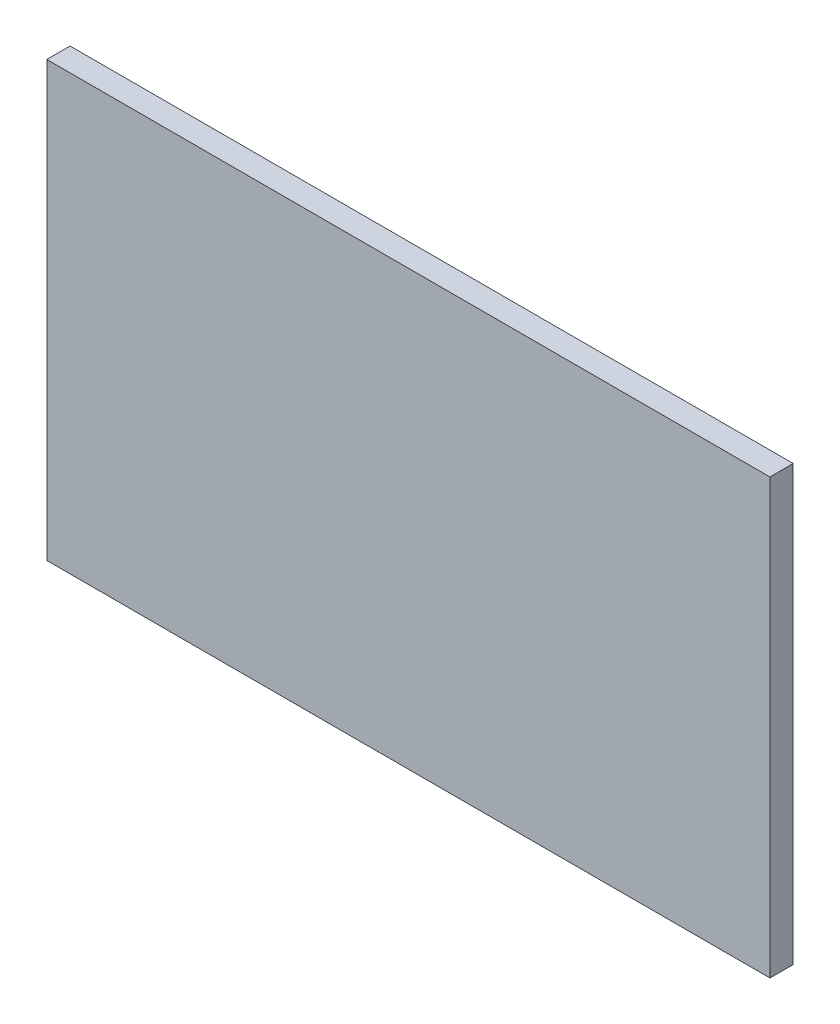
from build123d import *

# Parameters (mm, degrees)
CROQUIS1_W              = 50
CROQUIS1_H              = 30
SALIENTE_EXTRUIR1_DEPTH = 1.61


with BuildPart() as part:
    # Croquis1 → Saliente-Extruir1 (new body)
    with BuildSketch(Plane.XY):
        with Locations((25, -15)):
            Rectangle(CROQUIS1_W, CROQUIS1_H)
    extrude(amount=SALIENTE_EXTRUIR1_DEPTH)


solid = part.part
